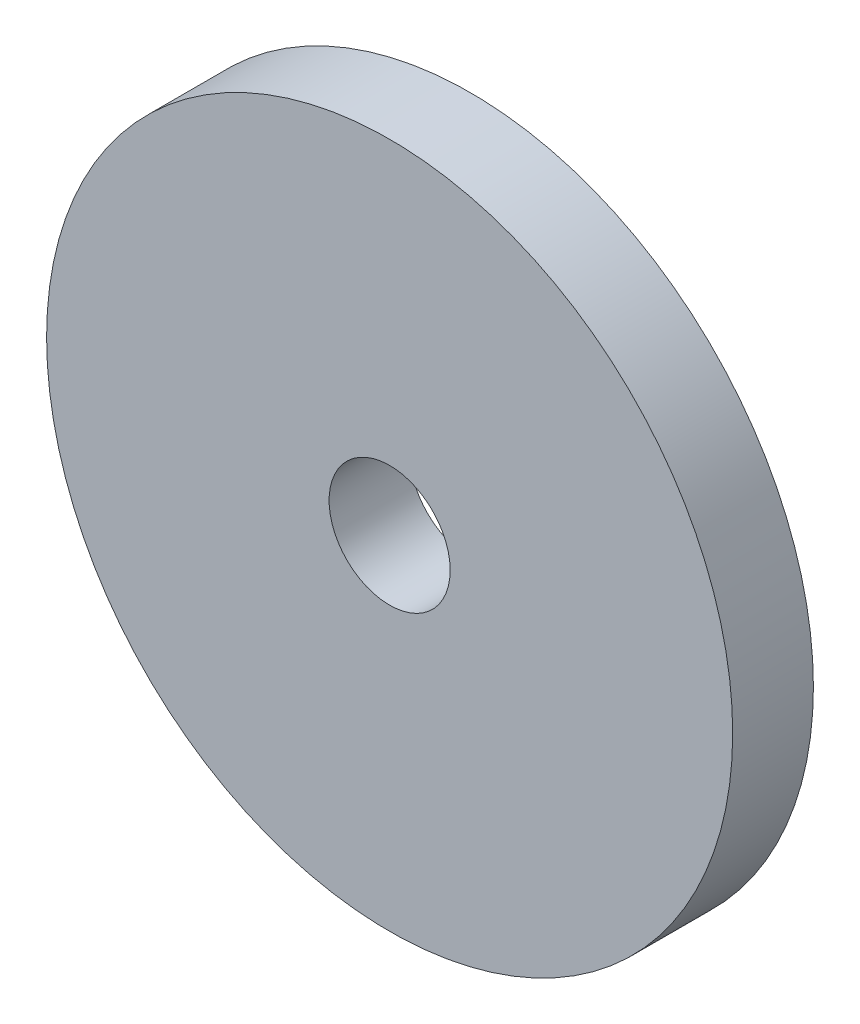
from build123d import *

# Parameters (mm, degrees)
SKETCH1_R           = 17
SKETCH1_R_2         = 3
BOSS_EXTRUDE1_DEPTH = 4


with BuildPart() as part:
    # Sketch1 → Boss-Extrude1 (new body)
    with BuildSketch(Plane.XY):
        with Locations((19.750003067, 9.999998036)):
            Circle(SKETCH1_R)
        with Locations((19.750003067, 9.999998036)):
            Circle(SKETCH1_R_2, mode=Mode.SUBTRACT)
    extrude(amount=BOSS_EXTRUDE1_DEPTH)


solid = part.part
